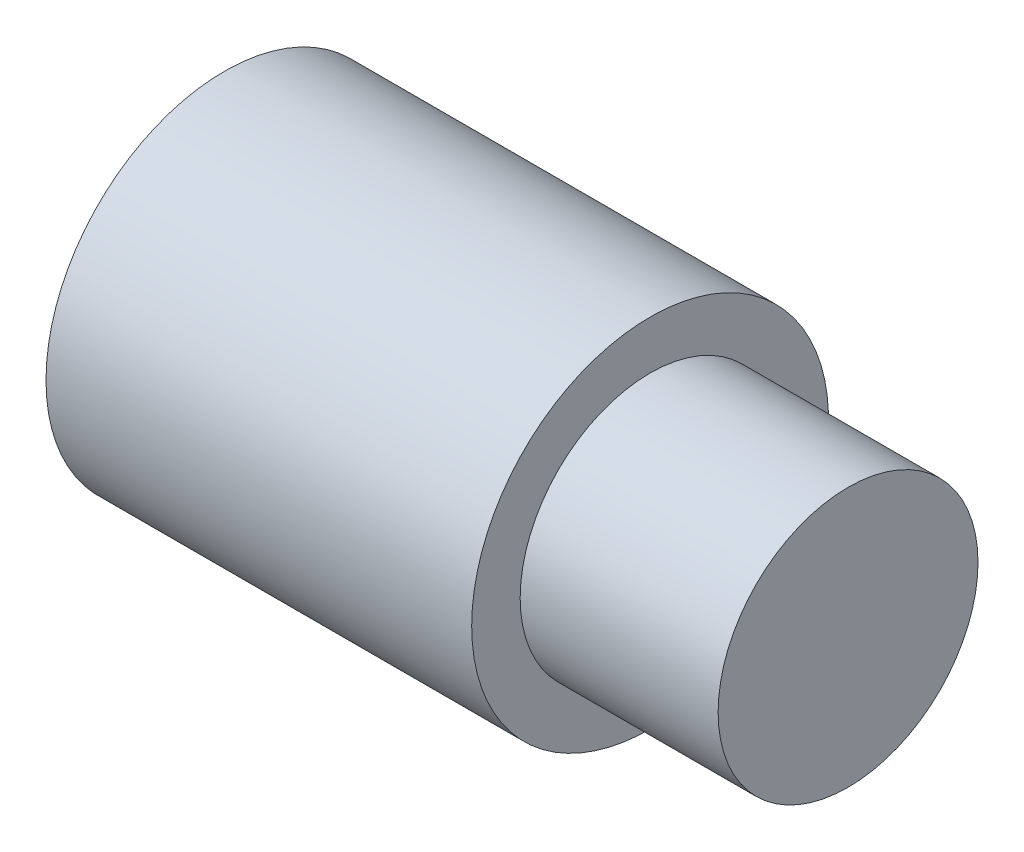
from build123d import *

# Parameters (mm, degrees)
SOCKET_SKETCH_W = 23.9
SOCKET_SKETCH_H = 6.35


with BuildPart() as part:
    # Conn_T8_ORB8 Sketch → Conn_T8_ORB8 (revolve)
    with BuildSketch(Plane.XY):
        Polygon((13.3, 0), (13.3, 8.73), (0, 8.73), (0, 11.988), (-28.6, 11.988), (-28.6, 0), align=None)
    revolve(axis=Axis((-1000, 0, 0), (1, 0, 0)))

    # Socket Sketch → Socket (revolve, cut)
    with BuildSketch(Plane.XY):
        with Locations((-17.65, 3.175)):
            Rectangle(SOCKET_SKETCH_W, SOCKET_SKETCH_H)
    revolve(axis=Axis((-1000, 0, 0), (1, 0, 0)), mode=Mode.SUBTRACT)


solid = part.part
